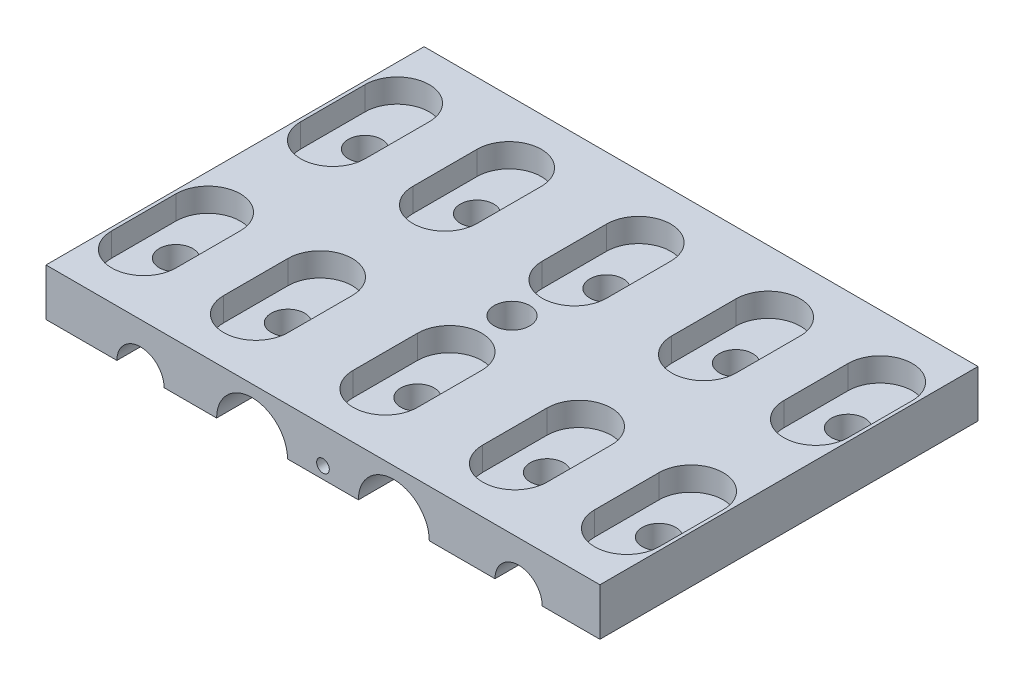
from build123d import *

# Parameters (mm, degrees)
SKETCH1_W             = 74.422
SKETCH1_H             = 50.8
BOSS_EXTRUDE1_DEPTH   = 6.35
SKETCH2_R             = 3.175
CUT_EXTRUDE1_DEPTH    = 64.289975675
SKETCH3_R             = 4.7625
CUT_EXTRUDE2_DEPTH    = 64.289975675
F_8_CLEARANCE_HOLE1_D = 4.4958
CUT_EXTRUDE3_DEPTH    = 3.175
SKETCH7_R             = 2.38125
CUT_EXTRUDE4_DEPTH    = 46.498802413
SKETCH8_R             = 0.8509
CUT_EXTRUDE5_DEPTH    = 9.525


with BuildPart() as part:
    # Sketch1 → Boss-Extrude1 (new body)
    with BuildSketch(Plane(origin=(0, 0, 0), x_dir=(1, 0, 0), z_dir=(0, 1, 0))):
        Rectangle(SKETCH1_W, SKETCH1_H)
    extrude(amount=BOSS_EXTRUDE1_DEPTH)

    # Sketch2 → Cut-Extrude1 (cut, through all)
    with BuildSketch(Plane.XY.offset(25.4)):
        with Locations((-24.511, 0)):
            Circle(SKETCH2_R)
        with Locations((26.289, 0)):
            Circle(SKETCH2_R)
    extrude(amount=-CUT_EXTRUDE1_DEPTH, mode=Mode.SUBTRACT)

    # Sketch3 → Cut-Extrude2 (cut, through all)
    with BuildSketch(Plane.XY.offset(25.4)):
        with Locations((-9.525, 0)):
            Circle(SKETCH3_R)
        with Locations((9.525, 0)):
            Circle(SKETCH3_R)
    extrude(amount=-CUT_EXTRUDE2_DEPTH, mode=Mode.SUBTRACT)

    # #8 Clearance Hole1 (through all)
    with Locations(Plane(origin=(0, 6.35, 0), x_dir=(1, 0, 0), z_dir=(0, 1, 0))):
        with Locations((-32.4485, 12.7), (-32.4485, -12.7), (-17.399, -12.7), (0, -12.7), (17.399, -12.7), (32.4485, -12.7), (32.4485, 12.7), (17.399, 12.7), (0, 12.7), (-17.399, 12.7)):
            Hole(F_8_CLEARANCE_HOLE1_D / 2)

    # Sketch6 → Cut-Extrude3 (cut)
    with BuildSketch(Plane(origin=(0, 6.35, 0), x_dir=(1, 0, 0), z_dir=(0, 1, 0))):
        with BuildLine():
            Line((-13.081, 17.018), (-13.081, 8.382))
            ThreePointArc((-13.081, 8.382), (-17.399, 4.064), (-21.717, 8.382))
            Line((-21.717, 8.382), (-21.717, 17.018))
            ThreePointArc((-21.717, 17.018), (-17.399, 21.336), (-13.081, 17.018))
        make_face()
        with BuildLine():
            Line((13.081, 17.018), (13.081, 8.382))
            ThreePointArc((13.081, 8.382), (17.399, 4.064), (21.717, 8.382))
            Line((21.717, 8.382), (21.717, 17.018))
            ThreePointArc((21.717, 17.018), (17.399, 21.336), (13.081, 17.018))
        make_face()
        with BuildLine():
            Line((13.081, -17.018), (13.081, -8.382))
            ThreePointArc((13.081, -8.382), (17.399, -4.064), (21.717, -8.382))
            Line((21.717, -8.382), (21.717, -17.018))
            ThreePointArc((21.717, -17.018), (17.399, -21.336), (13.081, -17.018))
        make_face()
        with BuildLine():
            Line((-13.081, -17.018), (-13.081, -8.382))
            ThreePointArc((-13.081, -8.382), (-17.399, -4.064), (-21.717, -8.382))
            Line((-21.717, -8.382), (-21.717, -17.018))
            ThreePointArc((-21.717, -17.018), (-17.399, -21.336), (-13.081, -17.018))
        make_face()
        with BuildLine():
            Line((4.318, 17.018), (4.318, 8.382))
            ThreePointArc((4.318, 8.382), (0, 4.064), (-4.318, 8.382))
            Line((-4.318, 8.382), (-4.318, 17.018))
            ThreePointArc((-4.318, 17.018), (0, 21.336), (4.318, 17.018))
        make_face()
        with BuildLine():
            Line((4.318, -17.018), (4.318, -8.382))
            ThreePointArc((4.318, -8.382), (0, -4.064), (-4.318, -8.382))
            Line((-4.318, -8.382), (-4.318, -17.018))
            ThreePointArc((-4.318, -17.018), (0, -21.336), (4.318, -17.018))
        make_face()
        with BuildLine():
            Line((-28.1305, 17.018), (-28.1305, 8.382))
            ThreePointArc((-28.1305, 8.382), (-32.4485, 4.064), (-36.7665, 8.382))
            Line((-36.7665, 8.382), (-36.7665, 17.018))
            ThreePointArc((-36.7665, 17.018), (-32.4485, 21.336), (-28.1305, 17.018))
        make_face()
        with BuildLine():
            Line((-28.1305, -17.018), (-28.1305, -8.382))
            ThreePointArc((-28.1305, -8.382), (-32.4485, -4.064), (-36.7665, -8.382))
            Line((-36.7665, -8.382), (-36.7665, -17.018))
            ThreePointArc((-36.7665, -17.018), (-32.4485, -21.336), (-28.1305, -17.018))
        make_face()
        with BuildLine():
            Line((28.1305, 17.018), (28.1305, 8.382))
            ThreePointArc((28.1305, 8.382), (32.4485, 4.064), (36.7665, 8.382))
            Line((36.7665, 8.382), (36.7665, 17.018))
            ThreePointArc((36.7665, 17.018), (32.4485, 21.336), (28.1305, 17.018))
        make_face()
        with BuildLine():
            Line((28.1305, -17.018), (28.1305, -8.382))
            ThreePointArc((28.1305, -8.382), (32.4485, -4.064), (36.7665, -8.382))
            Line((36.7665, -8.382), (36.7665, -17.018))
            ThreePointArc((36.7665, -17.018), (32.4485, -21.336), (28.1305, -17.018))
        make_face()
    extrude(amount=-CUT_EXTRUDE3_DEPTH, mode=Mode.SUBTRACT)

    # Sketch7 → Cut-Extrude4 (cut, through all)
    with BuildSketch(Plane(origin=(0, 6.35, 0), x_dir=(1, 0, 0), z_dir=(0, 1, 0))):
        with Locations(Location((0, 0, 0), (0, 0, 270))):
            Circle(SKETCH7_R)
    extrude(amount=-CUT_EXTRUDE4_DEPTH, mode=Mode.SUBTRACT)

    # Sketch8 → Cut-Extrude5 (cut)
    with BuildSketch(Plane.XY.offset(25.4)):
        with Locations((0, 1.5875)):
            Circle(SKETCH8_R)
    extrude(amount=-CUT_EXTRUDE5_DEPTH, mode=Mode.SUBTRACT)


solid = part.part
